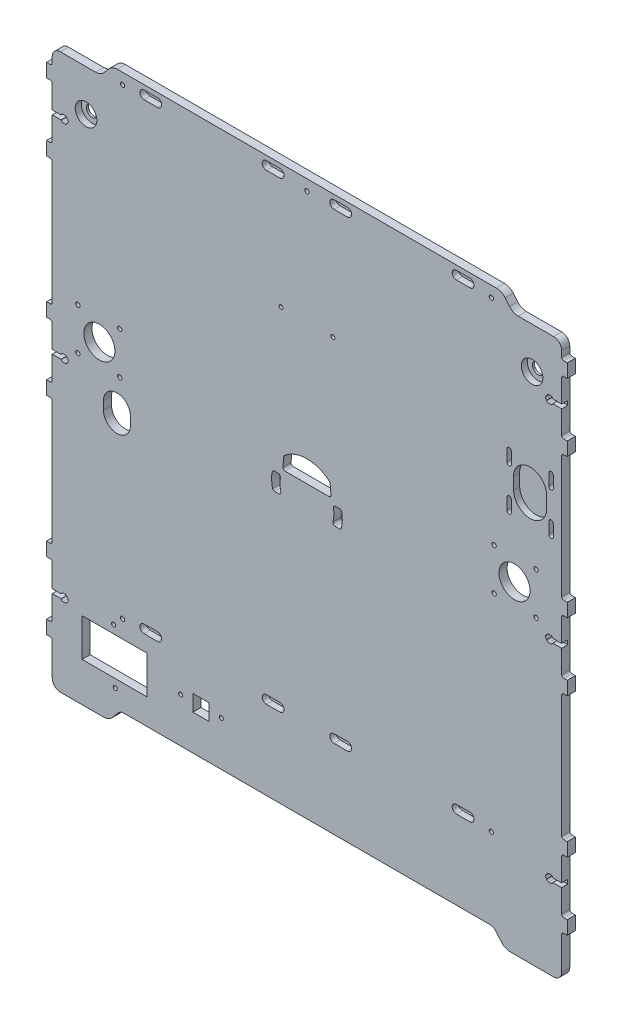
from build123d import *

# Parameters (mm, degrees)
CROQUIS1_R              = 1.6
CROQUIS1_R_2            = 1.5
CROQUIS1_R_3            = 11.5
CROQUIS1_R_4            = 4.25
CROQUIS1_W              = 48
CROQUIS1_H              = 28
CROQUIS1_W_2            = 12
CROQUIS1_H_2            = 12
SALIENTE_EXTRUIR1_DEPTH = 6
CORTAR_EXTRUIR4_START   = -4.5
CROQUIS10_R             = 8
CROQUIS10_R_2           = 4.25
CORTAR_EXTRUIR4_DEPTH   = 4.5
CHAFL_N1_SIZE           = 1.5
CROQUIS11_R             = 1.500000001
CORTAR_EXTRUIR5_DEPTH   = 6


with BuildPart() as part:
    # Croquis1 → Saliente-Extruir1 (new body)
    with BuildSketch(Plane.XY):
        with BuildLine():
            Line((-222.95465507, 205.76041627), (-222.95465507, 168.86041627))
            ThreePointArc((-222.95465507, 168.86041627), (-223.408639559, 167.764400759), (-224.50465507, 167.31041627))
            Line((-224.50465507, 167.31041627), (-227.10465507, 167.31041627))
            Line((-227.10465507, 167.31041627), (-227.10465507, 157.31041627))
            Line((-227.10465507, 157.31041627), (-224.50465507, 157.31041627))
            ThreePointArc((-224.50465507, 157.31041627), (-223.408639559, 156.856431781), (-222.95465507, 155.76041627))
            Line((-222.95465507, 155.76041627), (-222.95465507, 65.56041627))
            ThreePointArc((-222.95465507, 65.56041627), (-223.408639559, 64.464400759), (-224.50465507, 64.01041627))
            Line((-224.50465507, 64.01041627), (-227.10465507, 64.01041627))
            Line((-227.10465507, 64.01041627), (-227.10465507, 54.01041627))
            Line((-227.10465507, 54.01041627), (-224.50465507, 54.01041627))
            ThreePointArc((-224.50465507, 54.01041627), (-223.408639559, 53.556431781), (-222.95465507, 52.46041627))
            Line((-222.95465507, 52.46041627), (-222.95465507, 15.56041627))
            ThreePointArc((-222.95465507, 15.56041627), (-223.408639559, 14.464400759), (-224.50465507, 14.01041627))
            Line((-224.50465507, 14.01041627), (-227.10465507, 14.01041627))
            Line((-227.10465507, 14.01041627), (-227.10465507, 4.01041627))
            Line((-227.10465507, 4.01041627), (-224.50465507, 4.01041627))
            ThreePointArc((-224.50465507, 4.01041627), (-223.408639559, 3.556431781), (-222.95465507, 2.461099925))
            Line((-222.95465507, 2.461099925), (-222.95465507, -87.73958373))
            ThreePointArc((-222.95465507, -87.73958373), (-223.408639559, -88.835599241), (-224.50465507, -89.28958373))
            Line((-224.50465507, -89.28958373), (-227.10465507, -89.28958373))
            Line((-227.10465507, -89.28958373), (-227.10465507, -99.28958373))
            Line((-227.10465507, -99.28958373), (-224.50465507, -99.28958373))
            ThreePointArc((-224.50465507, -99.28958373), (-223.408639559, -99.743568219), (-222.95465507, -100.83958373))
            Line((-222.95465507, -100.83958373), (-222.95465507, -137.73958373))
            ThreePointArc((-222.95465507, -137.73958373), (-223.408639559, -138.835599241), (-224.50465507, -139.28958373))
            Line((-224.50465507, -139.28958373), (-227.10465507, -139.28958373))
            Line((-227.10465507, -139.28958373), (-227.10465507, -149.28958373))
            Line((-227.10465507, -149.28958373), (-224.50465507, -149.28958373))
            ThreePointArc((-224.50465507, -149.28958373), (-223.408639559, -149.743568219), (-222.95465507, -150.83958373))
            Line((-222.95465507, -150.83958373), (-222.95465507, -174.98958373))
            ThreePointArc((-222.95465507, -174.98958373), (-221.197295757, -179.232224417), (-216.95465507, -180.98958373))
            Line((-216.95465507, -180.98958373), (-184.95465507, -180.98958373))
            ThreePointArc((-184.95465507, -180.98958373), (-181.362399845, -180.19319992), (-178.443277303, -177.953278412))
            Line((-178.443277303, -177.953278412), (-174.251121407, -172.957261563))
            ThreePointArc((-174.251121407, -172.957261563), (-172.359383879, -171.505680303), (-170.031422678, -170.98958373))
            Line((-170.031422678, -170.98958373), (100.822112538, -170.98958373))
            ThreePointArc((100.822112538, -170.98958373), (103.15007374, -171.505680303), (105.041811268, -172.957261563))
            Line((105.041811268, -172.957261563), (109.233967164, -177.953278412))
            ThreePointArc((109.233967164, -177.953278412), (112.153089706, -180.19319992), (115.74534493, -180.98958373))
            Line((115.74534493, -180.98958373), (147.74534493, -180.98958373))
            ThreePointArc((147.74534493, -180.98958373), (151.987985617, -179.232224417), (153.74534493, -174.98958373))
            Line((153.74534493, -174.98958373), (153.74534493, -150.83958373))
            ThreePointArc((153.74534493, -150.83958373), (154.19932942, -149.743568219), (155.29534493, -149.28958373))
            Line((155.29534493, -149.28958373), (157.89534493, -149.28958373))
            Line((157.89534493, -149.28958373), (157.89534493, -139.28958373))
            Line((157.89534493, -139.28958373), (155.29534493, -139.28958373))
            ThreePointArc((155.29534493, -139.28958373), (154.19932942, -138.835599241), (153.74534493, -137.73958373))
            Line((153.74534493, -137.73958373), (153.74534493, -100.83958373))
            ThreePointArc((153.74534493, -100.83958373), (154.19932942, -99.743568219), (155.29534493, -99.28958373))
            Line((155.29534493, -99.28958373), (157.89534493, -99.28958373))
            Line((157.89534493, -99.28958373), (157.89534493, -89.28958373))
            Line((157.89534493, -89.28958373), (155.29534493, -89.28958373))
            ThreePointArc((155.29534493, -89.28958373), (154.19932942, -88.835599241), (153.74534493, -87.73958373))
            Line((153.74534493, -87.73958373), (153.74534493, 2.461099925))
            ThreePointArc((153.74534493, 2.461099925), (154.19932942, 3.556431781), (155.29534493, 4.01041627))
            Line((155.29534493, 4.01041627), (157.89534493, 4.01041627))
            Line((157.89534493, 4.01041627), (157.89534493, 14.01041627))
            Line((157.89534493, 14.01041627), (155.29534493, 14.01041627))
            ThreePointArc((155.29534493, 14.01041627), (154.19932942, 14.464400759), (153.74534493, 15.56041627))
            Line((153.74534493, 15.56041627), (153.74534493, 52.46041627))
            ThreePointArc((153.74534493, 52.46041627), (154.19932942, 53.556431781), (155.29534493, 54.01041627))
            Line((155.29534493, 54.01041627), (157.89534493, 54.01041627))
            Line((157.89534493, 54.01041627), (157.89534493, 64.01041627))
            Line((157.89534493, 64.01041627), (155.29534493, 64.01041627))
            ThreePointArc((155.29534493, 64.01041627), (154.19932942, 64.464400759), (153.74534493, 65.56041627))
            Line((153.74534493, 65.56041627), (153.74534493, 155.76041627))
            ThreePointArc((153.74534493, 155.76041627), (154.19932942, 156.856431781), (155.29534493, 157.31041627))
            Line((155.29534493, 157.31041627), (157.89534493, 157.31041627))
            Line((157.89534493, 157.31041627), (157.89534493, 167.31041627))
            Line((157.89534493, 167.31041627), (155.29534493, 167.31041627))
            ThreePointArc((155.29534493, 167.31041627), (154.19932942, 167.764400759), (153.74534493, 168.86041627))
            Line((153.74534493, 168.86041627), (153.74534493, 205.76041627))
            ThreePointArc((153.74534493, 205.76041627), (154.19932942, 206.856431781), (155.29534493, 207.31041627))
            Line((155.29534493, 207.31041627), (157.89534493, 207.31041627))
            Line((157.89534493, 207.31041627), (157.89534493, 217.31041627))
            Line((157.89534493, 217.31041627), (155.29534493, 217.31041627))
            ThreePointArc((155.29534493, 217.31041627), (154.19932942, 217.764400759), (153.74534493, 218.86041627))
            Line((153.74534493, 218.86041627), (153.74534493, 223.11041627))
            ThreePointArc((153.74534493, 223.11041627), (151.987985617, 227.353056957), (147.74534493, 229.11041627))
            Line((147.74534493, 229.11041627), (121.74534493, 229.11041627))
            ThreePointArc((121.74534493, 229.11041627), (118.153089706, 229.90680008), (115.233967164, 232.146721588))
            Line((115.233967164, 232.146721588), (112.02240616, 235.974110952))
            ThreePointArc((112.02240616, 235.974110952), (109.103283618, 238.21403246), (105.511028393, 239.01041627))
            Line((105.511028393, 239.01041627), (-174.720338532, 239.01041627))
            ThreePointArc((-174.720338532, 239.01041627), (-178.312593757, 238.21403246), (-181.231716299, 235.974110952))
            Line((-181.231716299, 235.974110952), (-184.443277303, 232.146721588))
            ThreePointArc((-184.443277303, 232.146721588), (-187.362399845, 229.90680008), (-190.95465507, 229.11041627))
            Line((-190.95465507, 229.11041627), (-216.95465507, 229.11041627))
            ThreePointArc((-216.95465507, 229.11041627), (-221.197295757, 227.353056957), (-222.95465507, 223.11041627))
            Line((-222.95465507, 223.11041627), (-222.95465507, 218.86041627))
            ThreePointArc((-222.95465507, 218.86041627), (-223.408639559, 217.764400759), (-224.50465507, 217.31041627))
            Line((-224.50465507, 217.31041627), (-227.10465507, 217.31041627))
            Line((-227.10465507, 217.31041627), (-227.10465507, 207.31041627))
            Line((-227.10465507, 207.31041627), (-224.50465507, 207.31041627))
            ThreePointArc((-224.50465507, 207.31041627), (-223.408639559, 206.856431781), (-222.95465507, 205.76041627))
        make_face()
        with Locations((101.74534493, 231.01041627)):
            Circle(CROQUIS1_R, mode=Mode.SUBTRACT)
        with Locations((-34.60465507, 231.01041627)):
            Circle(CROQUIS1_R, mode=Mode.SUBTRACT)
        with Locations((101.74534493, -110.98958373)):
            Circle(CROQUIS1_R, mode=Mode.SUBTRACT)
        with Locations((-177.55465507, -117.98958373)):
            Circle(CROQUIS1_R_2, mode=Mode.SUBTRACT)
        with Locations((-176.35465507, -157.98958373)):
            Circle(CROQUIS1_R_2, mode=Mode.SUBTRACT)
        with Locations((-188.10465507, 57.61041627)):
            Circle(CROQUIS1_R_3, mode=Mode.SUBTRACT)
        with Locations((-204.028904264, 73.61041627)):
            Circle(CROQUIS1_R, mode=Mode.SUBTRACT)
        with Locations((-173.028904264, 73.61041627)):
            Circle(CROQUIS1_R, mode=Mode.SUBTRACT)
        with Locations((-204.028904264, 42.61041627)):
            Circle(CROQUIS1_R, mode=Mode.SUBTRACT)
        with Locations((-173.028904264, 42.61041627)):
            Circle(CROQUIS1_R, mode=Mode.SUBTRACT)
        with Locations((-127.95465507, -137.98958373)):
            Circle(CROQUIS1_R_2, mode=Mode.SUBTRACT)
        with Locations((-197.95465507, 198.61041627)):
            Circle(CROQUIS1_R_4, mode=Mode.SUBTRACT)
        with Locations((-170.95465507, 231.01041627)):
            Circle(CROQUIS1_R, mode=Mode.SUBTRACT)
        with Locations((-97.95465507, -137.98958373)):
            Circle(CROQUIS1_R_2, mode=Mode.SUBTRACT)
        with Locations((103.819594125, 42.61041627)):
            Circle(CROQUIS1_R, mode=Mode.SUBTRACT)
        with Locations((134.819594125, 42.61041627)):
            Circle(CROQUIS1_R, mode=Mode.SUBTRACT)
        with Locations((103.819594125, 73.61041627)):
            Circle(CROQUIS1_R, mode=Mode.SUBTRACT)
        with Locations((131.89534493, 198.61041627)):
            Circle(CROQUIS1_R_4, mode=Mode.SUBTRACT)
        with Locations((134.819594125, 73.61041627)):
            Circle(CROQUIS1_R, mode=Mode.SUBTRACT)
        with Locations((118.89534493, 57.61041627)):
            Circle(CROQUIS1_R_3, mode=Mode.SUBTRACT)
        with Locations((-170.95465507, -110.98958373)):
            Circle(CROQUIS1_R, mode=Mode.SUBTRACT)
        with BuildLine():
            Line((-10.679520234, 26.776689028), (-13.879047758, 26.776689029))
            ThreePointArc((-13.879047758, 26.776689029), (-15.111568899, 27.386745082), (-15.373940312, 28.736722116))
            ThreePointArc((-15.373940312, 28.736722116), (-14.67762389, 33.27172253), (-15.036266273, 37.845830196))
            ThreePointArc((-15.036266273, 37.845830196), (-14.711977039, 39.129015944), (-13.51512475, 39.694059098))
            Line((-13.51512475, 39.694059098), (-10.363583155, 39.694059098))
            ThreePointArc((-10.363583155, 39.694059098), (-9.363864345, 39.328594449), (-8.835554553, 38.40453229))
            ThreePointArc((-8.835554553, 38.40453229), (-8.47712568, 33.169580365), (-9.171406629, 27.968506737))
            ThreePointArc((-9.171406629, 27.968506737), (-9.718422412, 27.110610351), (-10.679520234, 26.776689028))
        make_face(mode=Mode.SUBTRACT)
        with BuildLine():
            Line((-16.82698114, 45.302421524), (-17.454641005, 52.476606606))
            ThreePointArc((-17.454641005, 52.476606606), (-17.621340665, 53.052347784), (-17.994005363, 53.521802473))
            ThreePointArc((-17.994005363, 53.521802473), (-34.60465507, 59.634777242), (-51.215304777, 53.521802473))
            ThreePointArc((-51.215304777, 53.521802473), (-51.587969474, 53.052347784), (-51.754669134, 52.476606606))
            Line((-51.754669134, 52.476606606), (-52.382328999, 45.302421524))
            ThreePointArc((-52.382328999, 45.302421524), (-51.980985234, 44.120100919), (-50.83814313, 43.617238358))
            Line((-50.83814313, 43.617238358), (-18.371167009, 43.617238358))
            ThreePointArc((-18.371167009, 43.617238358), (-17.228324905, 44.120100919), (-16.82698114, 45.302421524))
        make_face(mode=Mode.SUBTRACT)
        with BuildLine():
            Line((-58.529789905, 26.776689028), (-55.330262382, 26.776689029))
            ThreePointArc((-55.330262382, 26.776689029), (-54.09774124, 27.386745082), (-53.835369827, 28.736722116))
            ThreePointArc((-53.835369827, 28.736722116), (-54.53168625, 33.27172253), (-54.173043867, 37.845830196))
            ThreePointArc((-54.173043867, 37.845830196), (-54.4973331, 39.129015944), (-55.694185389, 39.694059098))
            Line((-55.694185389, 39.694059098), (-58.845726984, 39.694059098))
            ThreePointArc((-58.845726984, 39.694059098), (-59.845445795, 39.328594449), (-60.373755586, 38.40453229))
            ThreePointArc((-60.373755586, 38.40453229), (-60.73218446, 33.169580365), (-60.03790351, 27.968506737))
            ThreePointArc((-60.03790351, 27.968506737), (-59.490887728, 27.110610351), (-58.529789905, 26.776689028))
        make_face(mode=Mode.SUBTRACT)
        with BuildLine():
            Line((-185.10465507, 15.61041627), (-185.10465507, 21.61041627))
            ThreePointArc((-185.10465507, 21.61041627), (-175.10465507, 31.61041627), (-165.10465507, 21.61041627))
            Line((-165.10465507, 21.61041627), (-165.10465507, 15.61041627))
            ThreePointArc((-165.10465507, 15.61041627), (-175.10465507, 5.61041627), (-185.10465507, 15.61041627))
        make_face(mode=Mode.SUBTRACT)
        with Locations((-176.95465507, -137.98958373)):
            Rectangle(CROQUIS1_W, CROQUIS1_H, mode=Mode.SUBTRACT)
        with BuildLine():
            Line((113.242522345, 131.610299427), (113.241921566, 140.110299406))
            ThreePointArc((113.241921566, 140.110299406), (114.895228067, 141.763839634), (116.548768295, 140.110533134))
            Line((116.548768295, 140.110533134), (116.549369073, 131.610533155))
            ThreePointArc((116.549369073, 131.610533155), (114.896062572, 129.956992927), (113.242522345, 131.610299427))
        make_face(mode=Mode.SUBTRACT)
        with BuildLine():
            Line((144.242522345, 131.610299427), (144.241921566, 140.110299406))
            ThreePointArc((144.241921566, 140.110299406), (145.895228067, 141.763839634), (147.548768295, 140.110533134))
            Line((147.548768295, 140.110533134), (147.549369073, 131.610533155))
            ThreePointArc((147.549369073, 131.610533155), (145.896062572, 129.956992927), (144.242522345, 131.610299427))
        make_face(mode=Mode.SUBTRACT)
        with BuildLine():
            Line((113.242522345, 100.610299457), (113.241921566, 109.110299435))
            ThreePointArc((113.241921566, 109.110299435), (114.895228067, 110.763839663), (116.548768295, 109.110533163))
            Line((116.548768295, 109.110533163), (116.549369073, 100.610533184))
            ThreePointArc((116.549369073, 100.610533184), (114.896062572, 98.956992956), (113.242522345, 100.610299457))
        make_face(mode=Mode.SUBTRACT)
        with BuildLine():
            Line((144.242522345, 100.610299457), (144.241921566, 109.110299435))
            ThreePointArc((144.241921566, 109.110299435), (145.895228067, 110.763839663), (147.548768295, 109.110533163))
            Line((147.548768295, 109.110533163), (147.549369073, 100.610533184))
            ThreePointArc((147.549369073, 100.610533184), (145.896062572, 98.956992956), (144.242522345, 100.610299457))
        make_face(mode=Mode.SUBTRACT)
        with Locations((-112.95465507, -138.821397395)):
            Rectangle(CROQUIS1_W_2, CROQUIS1_H_2, mode=Mode.SUBTRACT)
    extrude(amount=SALIENTE_EXTRUIR1_DEPTH)

    # Croquis10 → Cortar-Extruir4 (cut)
    # profile 1 of 17: a face of its own
    with BuildSketch(Plane.XY.offset(6).offset(CORTAR_EXTRUIR4_START)):
        with Locations((-197.95465507, 198.61041627)):
            Circle(CROQUIS10_R)
    # profile 2 of 17: a face of its own
    with BuildSketch(Plane.XY.offset(6).offset(CORTAR_EXTRUIR4_START)):
        with Locations((131.89534493, 198.61041627)):
            Circle(CROQUIS10_R)
        with Locations((131.89534493, 198.61041627)):
            Circle(CROQUIS10_R_2, mode=Mode.SUBTRACT)
    # profile 3 of 17: a face of its own
    with BuildSketch(Plane.XY.offset(6).offset(CORTAR_EXTRUIR4_START)):
        with BuildLine():
            Line((142.672030658, 116.161086189), (142.672030658, 124.610416255))
            ThreePointArc((142.672030658, 124.610416255), (130.324024601, 136.886894817), (118.119487861, 124.467778004))
            Line((118.119487861, 124.467778004), (118.217657489, 116.019018255))
            ThreePointArc((118.217657489, 116.019018255), (130.515466567, 103.93369327), (142.672030658, 116.161086189))
        make_face()
    # profile 4 of 17: a face of its own
    with BuildSketch(Plane.XY.offset(6).offset(CORTAR_EXTRUIR4_START)):
        with BuildLine():
            Line((-216.454429827, 188.86041627), (-222.95465507, 188.86041627))
            Line((-222.95465507, 188.86041627), (-222.95465507, 185.76041627))
            Line((-222.95465507, 185.76041627), (-216.454429827, 185.76041627))
            ThreePointArc((-216.454429827, 185.76041627), (-215.908828016, 184.89695016), (-214.94446294, 184.56041627))
            Line((-214.94446294, 184.56041627), (-213.39446294, 184.56041627))
            ThreePointArc((-213.39446294, 184.56041627), (-212.424527577, 184.901397911), (-211.881340797, 185.77431899))
            Line((-211.881340797, 185.77431899), (-211.881340797, 185.943563923))
            ThreePointArc((-211.881340797, 185.943563923), (-211.062022675, 187.31041627), (-211.881340797, 188.677268617))
            Line((-211.881340797, 188.677268617), (-211.881340797, 188.84651355))
            ThreePointArc((-211.881340797, 188.84651355), (-212.424527577, 189.719434629), (-213.39446294, 190.06041627))
            Line((-213.39446294, 190.06041627), (-214.94446294, 190.06041627))
            ThreePointArc((-214.94446294, 190.06041627), (-215.908828016, 189.72388238), (-216.454429827, 188.86041627))
        make_face()
    # profile 5 of 17: a face of its own
    with BuildSketch(Plane.XY.offset(6).offset(CORTAR_EXTRUIR4_START)):
        with BuildLine():
            Line((-216.454429827, 35.56041627), (-222.95465507, 35.56041627))
            Line((-222.95465507, 35.56041627), (-222.95465507, 32.46041627))
            Line((-222.95465507, 32.46041627), (-216.454429827, 32.46041627))
            ThreePointArc((-216.454429827, 32.46041627), (-215.908828016, 31.59695016), (-214.94446294, 31.26041627))
            Line((-214.94446294, 31.26041627), (-213.39446294, 31.26041627))
            ThreePointArc((-213.39446294, 31.26041627), (-212.424527577, 31.601397911), (-211.881340797, 32.47431899))
            Line((-211.881340797, 32.47431899), (-211.881340797, 32.643563923))
            ThreePointArc((-211.881340797, 32.643563923), (-211.062022675, 34.01041627), (-211.881340797, 35.377268617))
            Line((-211.881340797, 35.377268617), (-211.881340797, 35.54651355))
            ThreePointArc((-211.881340797, 35.54651355), (-212.424527577, 36.419434629), (-213.39446294, 36.76041627))
            Line((-213.39446294, 36.76041627), (-214.94446294, 36.76041627))
            ThreePointArc((-214.94446294, 36.76041627), (-215.908828016, 36.42388238), (-216.454429827, 35.56041627))
        make_face()
    # profile 6 of 17: a face of its own
    with BuildSketch(Plane.XY.offset(6).offset(CORTAR_EXTRUIR4_START)):
        with BuildLine():
            Line((-216.454429827, -117.73958373), (-222.95465507, -117.73958373))
            Line((-222.95465507, -117.73958373), (-222.95465507, -120.83958373))
            Line((-222.95465507, -120.83958373), (-216.454429827, -120.83958373))
            ThreePointArc((-216.454429827, -120.83958373), (-215.908828016, -121.70304984), (-214.94446294, -122.03958373))
            Line((-214.94446294, -122.03958373), (-213.39446294, -122.03958373))
            ThreePointArc((-213.39446294, -122.03958373), (-212.424527577, -121.698602089), (-211.881340797, -120.82568101))
            Line((-211.881340797, -120.82568101), (-211.881340797, -120.656436077))
            ThreePointArc((-211.881340797, -120.656436077), (-211.062022675, -119.28958373), (-211.881340797, -117.922731383))
            Line((-211.881340797, -117.922731383), (-211.881340797, -117.75348645))
            ThreePointArc((-211.881340797, -117.75348645), (-212.424527577, -116.880565371), (-213.39446294, -116.53958373))
            Line((-213.39446294, -116.53958373), (-214.94446294, -116.53958373))
            ThreePointArc((-214.94446294, -116.53958373), (-215.908828016, -116.87611762), (-216.454429827, -117.73958373))
        make_face()
    # profile 7 of 17: a face of its own
    with BuildSketch(Plane.XY.offset(6).offset(CORTAR_EXTRUIR4_START)):
        with BuildLine():
            Line((147.245119688, -120.83958373), (153.74534493, -120.83958373))
            Line((153.74534493, -120.83958373), (153.74534493, -117.73958373))
            Line((153.74534493, -117.73958373), (147.245119688, -117.73958373))
            ThreePointArc((147.245119688, -117.73958373), (146.699517877, -116.87611762), (145.735152801, -116.53958373))
            Line((145.735152801, -116.53958373), (144.185152801, -116.53958373))
            ThreePointArc((144.185152801, -116.53958373), (143.215217438, -116.880565371), (142.672030658, -117.75348645))
            Line((142.672030658, -117.75348645), (142.672030658, -117.922731383))
            ThreePointArc((142.672030658, -117.922731383), (141.852712535, -119.28958373), (142.672030658, -120.656436077))
            Line((142.672030658, -120.656436077), (142.672030658, -120.82568101))
            ThreePointArc((142.672030658, -120.82568101), (143.215217438, -121.698602089), (144.185152801, -122.03958373))
            Line((144.185152801, -122.03958373), (145.735152801, -122.03958373))
            ThreePointArc((145.735152801, -122.03958373), (146.699517877, -121.70304984), (147.245119688, -120.83958373))
        make_face()
    # profile 8 of 17: a face of its own
    with BuildSketch(Plane.XY.offset(6).offset(CORTAR_EXTRUIR4_START)):
        with BuildLine():
            Line((147.245119688, 32.46041627), (153.74534493, 32.46041627))
            Line((153.74534493, 32.46041627), (153.74534493, 35.56041627))
            Line((153.74534493, 35.56041627), (147.245119688, 35.56041627))
            ThreePointArc((147.245119688, 35.56041627), (146.699517877, 36.42388238), (145.735152801, 36.76041627))
            Line((145.735152801, 36.76041627), (144.185152801, 36.76041627))
            ThreePointArc((144.185152801, 36.76041627), (143.215217438, 36.419434629), (142.672030658, 35.54651355))
            Line((142.672030658, 35.54651355), (142.672030658, 35.377268617))
            ThreePointArc((142.672030658, 35.377268617), (141.852712535, 34.01041627), (142.672030658, 32.643563923))
            Line((142.672030658, 32.643563923), (142.672030658, 32.47431899))
            ThreePointArc((142.672030658, 32.47431899), (143.215217438, 31.601397911), (144.185152801, 31.26041627))
            Line((144.185152801, 31.26041627), (145.735152801, 31.26041627))
            ThreePointArc((145.735152801, 31.26041627), (146.699517877, 31.59695016), (147.245119688, 32.46041627))
        make_face()
    # profile 9 of 17: a face of its own
    with BuildSketch(Plane.XY.offset(6).offset(CORTAR_EXTRUIR4_START)):
        with BuildLine():
            Line((147.245119688, 185.76041627), (153.74534493, 185.76041627))
            Line((153.74534493, 185.76041627), (153.74534493, 188.86041627))
            Line((153.74534493, 188.86041627), (147.245119688, 188.86041627))
            ThreePointArc((147.245119688, 188.86041627), (146.699517877, 189.72388238), (145.735152801, 190.06041627))
            Line((145.735152801, 190.06041627), (144.185152801, 190.06041627))
            ThreePointArc((144.185152801, 190.06041627), (143.215217438, 189.719434629), (142.672030658, 188.84651355))
            Line((142.672030658, 188.84651355), (142.672030658, 188.677268617))
            ThreePointArc((142.672030658, 188.677268617), (141.852712535, 187.31041627), (142.672030658, 185.943563923))
            Line((142.672030658, 185.943563923), (142.672030658, 185.77431899))
            ThreePointArc((142.672030658, 185.77431899), (143.215217438, 184.901397911), (144.185152801, 184.56041627))
            Line((144.185152801, 184.56041627), (145.735152801, 184.56041627))
            ThreePointArc((145.735152801, 184.56041627), (146.699517877, 184.89695016), (147.245119688, 185.76041627))
        make_face()
    # profile 10 of 17: a face of its own
    with BuildSketch(Plane.XY.offset(6).offset(CORTAR_EXTRUIR4_START)):
        with BuildLine():
            Line((-64.60465507, 235.61041627), (-54.60465507, 235.61041627))
            ThreePointArc((-54.60465507, 235.61041627), (-51.50465507, 232.51041627), (-54.60465507, 229.41041627))
            Line((-54.60465507, 229.41041627), (-64.60465507, 229.41041627))
            ThreePointArc((-64.60465507, 229.41041627), (-67.70465507, 232.51041627), (-64.60465507, 235.61041627))
        make_face()
    # profile 11 of 17: a face of its own
    with BuildSketch(Plane.XY.offset(6).offset(CORTAR_EXTRUIR4_START)):
        with BuildLine():
            Line((-155.10465507, 235.61041627), (-145.10465507, 235.61041627))
            ThreePointArc((-145.10465507, 235.61041627), (-142.00465507, 232.51041627), (-145.10465507, 229.41041627))
            Line((-145.10465507, 229.41041627), (-155.10465507, 229.41041627))
            ThreePointArc((-155.10465507, 229.41041627), (-158.20465507, 232.51041627), (-155.10465507, 235.61041627))
        make_face()
    # profile 12 of 17: a face of its own
    with BuildSketch(Plane.XY.offset(6).offset(CORTAR_EXTRUIR4_START)):
        with BuildLine():
            Line((-4.60465507, 229.41041627), (-14.60465507, 229.41041627))
            ThreePointArc((-14.60465507, 229.41041627), (-17.70465507, 232.51041627), (-14.60465507, 235.61041627))
            Line((-14.60465507, 235.61041627), (-4.60465507, 235.61041627))
            ThreePointArc((-4.60465507, 235.61041627), (-1.50465507, 232.51041627), (-4.60465507, 229.41041627))
        make_face()
    # profile 13 of 17: a face of its own
    with BuildSketch(Plane.XY.offset(6).offset(CORTAR_EXTRUIR4_START)):
        with BuildLine():
            Line((85.89534493, 235.61041627), (75.89534493, 235.61041627))
            ThreePointArc((75.89534493, 235.61041627), (72.79534493, 232.51041627), (75.89534493, 229.41041627))
            Line((75.89534493, 229.41041627), (85.89534493, 229.41041627))
            ThreePointArc((85.89534493, 229.41041627), (88.99534493, 232.51041627), (85.89534493, 235.61041627))
        make_face()
    # profile 14 of 17: a face of its own
    with BuildSketch(Plane.XY.offset(6).offset(CORTAR_EXTRUIR4_START)):
        with BuildLine():
            Line((-64.60465507, -112.58958373), (-54.60465507, -112.58958373))
            ThreePointArc((-54.60465507, -112.58958373), (-51.50465507, -109.48958373), (-54.60465507, -106.38958373))
            Line((-54.60465507, -106.38958373), (-64.60465507, -106.38958373))
            ThreePointArc((-64.60465507, -106.38958373), (-67.70465507, -109.48958373), (-64.60465507, -112.58958373))
        make_face()
    # profile 15 of 17: a face of its own
    with BuildSketch(Plane.XY.offset(6).offset(CORTAR_EXTRUIR4_START)):
        with BuildLine():
            Line((-155.10465507, -106.38958373), (-145.10465507, -106.38958373))
            ThreePointArc((-145.10465507, -106.38958373), (-142.00465507, -109.48958373), (-145.10465507, -112.58958373))
            Line((-145.10465507, -112.58958373), (-155.10465507, -112.58958373))
            ThreePointArc((-155.10465507, -112.58958373), (-158.20465507, -109.48958373), (-155.10465507, -106.38958373))
        make_face()
    # profile 16 of 17: a face of its own
    with BuildSketch(Plane.XY.offset(6).offset(CORTAR_EXTRUIR4_START)):
        with BuildLine():
            Line((-4.60465507, -112.58958373), (-14.60465507, -112.58958373))
            ThreePointArc((-14.60465507, -112.58958373), (-17.70465507, -109.48958373), (-14.60465507, -106.38958373))
            Line((-14.60465507, -106.38958373), (-4.60465507, -106.38958373))
            ThreePointArc((-4.60465507, -106.38958373), (-1.50465507, -109.48958373), (-4.60465507, -112.58958373))
        make_face()
    # profile 17 of 17: a face of its own
    with BuildSketch(Plane.XY.offset(6).offset(CORTAR_EXTRUIR4_START)):
        with BuildLine():
            Line((85.89534493, -106.38958373), (75.89534493, -106.38958373))
            ThreePointArc((75.89534493, -106.38958373), (72.79534493, -109.48958373), (75.89534493, -112.58958373))
            Line((75.89534493, -112.58958373), (85.89534493, -112.58958373))
            ThreePointArc((85.89534493, -112.58958373), (88.99534493, -109.48958373), (85.89534493, -106.38958373))
        make_face()
    extrude(amount=CORTAR_EXTRUIR4_DEPTH, mode=Mode.SUBTRACT)

    # Chaflán1
    chafl_n1_edges = [part.edges().sort_by_distance(p)[0] for p in [
        (102.219594125, 73.61041627, 0),
        (102.219594125, 42.61041627, 0),
        (-99.45465507, -137.98958373, 0),
        (-172.55465507, 231.01041627, 0),
        (-129.45465507, -137.98958373, 0),
        (-174.628904264, 42.61041627, 0),
        (-205.628904264, 42.61041627, 0),
        (-174.628904264, 73.61041627, 0),
        (-205.628904264, 73.61041627, 0),
        (-177.85465507, -157.98958373, 0),
        (-179.05465507, -117.98958373, 0),
        (100.14534493, 231.01041627, 0),
        (-36.20465507, 231.01041627, 0),
        (100.14534493, -110.98958373, 0),
        (133.219594125, 42.61041627, 0),
        (133.219594125, 73.61041627, 0),
        (-172.55465507, -110.98958373, 0),
    ]]
    chamfer(chafl_n1_edges, length=CHAFL_N1_SIZE)

    # Croquis11 → Cortar-Extruir5 (cut)
    with BuildSketch(Plane.XY.offset(6)):
        with Locations((-53.78465507, 147.263839634)):
            Circle(CROQUIS11_R)
        with Locations((-15.42465507, 147.263839634)):
            Circle(CROQUIS11_R)
    extrude(amount=-CORTAR_EXTRUIR5_DEPTH, mode=Mode.SUBTRACT)


solid = part.part
